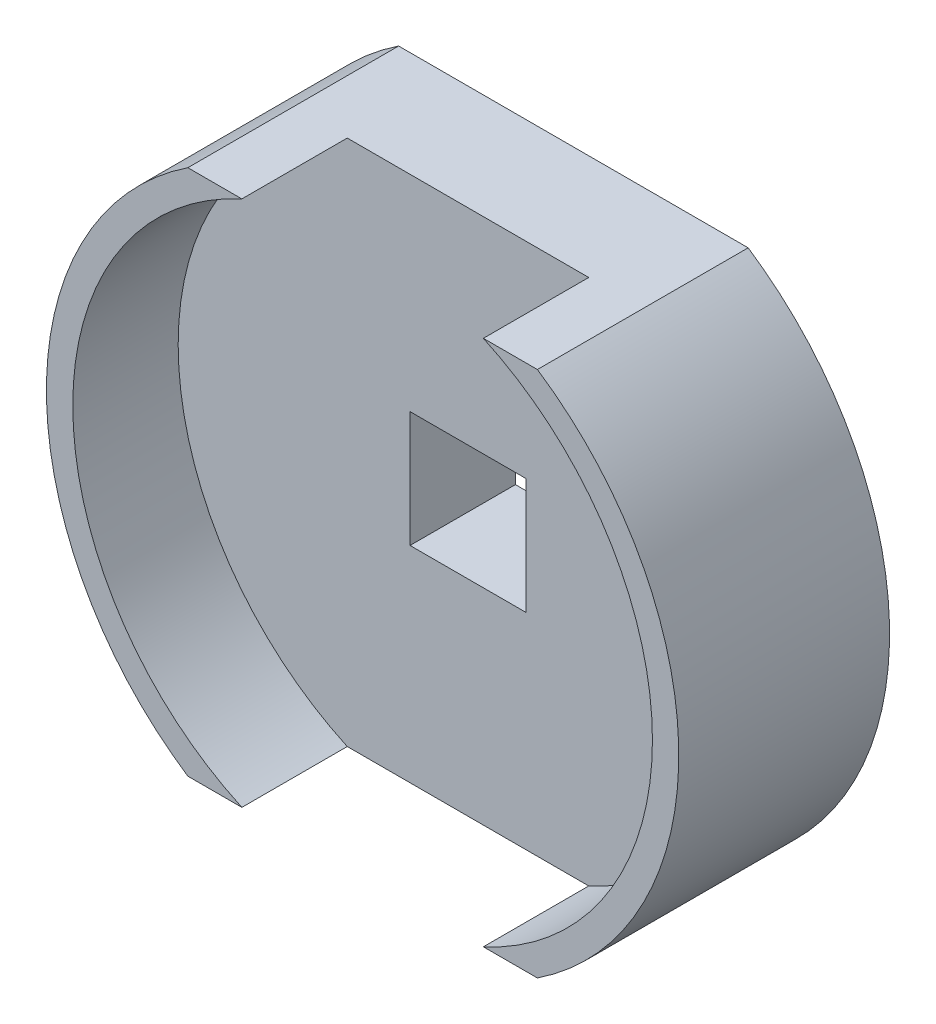
from build123d import *

# Parameters (mm, degrees)
SKETCH1_R           = 6
BOSS_EXTRUDE1_DEPTH = 2
SKETCH2_R           = 6
SKETCH2_R_2         = 5.5
BOSS_EXTRUDE2_DEPTH = 2
SKETCH7_W           = 24
SKETCH7_H           = 12
SKETCH7_W_2         = 20
SKETCH7_H_2         = 10
CUT_EXTRUDE1_DEPTH  = 6
SKETCH4_W           = 2.2
SKETCH4_H           = 2.2
CUT_EXTRUDE2_DEPTH  = 2


with BuildPart() as part:
    # Sketch1 → Boss-Extrude1 (new body)
    with BuildSketch(Plane.XY):
        Circle(SKETCH1_R)
    extrude(amount=BOSS_EXTRUDE1_DEPTH)

    # Sketch2 → Boss-Extrude2 (add)
    with BuildSketch(Plane.XY.offset(2)):
        Circle(SKETCH2_R)
        Circle(SKETCH2_R_2, mode=Mode.SUBTRACT)
    extrude(amount=BOSS_EXTRUDE2_DEPTH)

    # Sketch7 → Cut-Extrude1 (cut)
    with BuildSketch(Plane.XY):
        Rectangle(SKETCH7_W, SKETCH7_H)
        Rectangle(SKETCH7_W_2, SKETCH7_H_2, mode=Mode.SUBTRACT)
    extrude(amount=CUT_EXTRUDE1_DEPTH, mode=Mode.SUBTRACT)

    # Sketch4 → Cut-Extrude2 (cut)
    with BuildSketch(Plane.XY):
        Rectangle(SKETCH4_W, SKETCH4_H)
    extrude(amount=CUT_EXTRUDE2_DEPTH, mode=Mode.SUBTRACT)


solid = part.part
